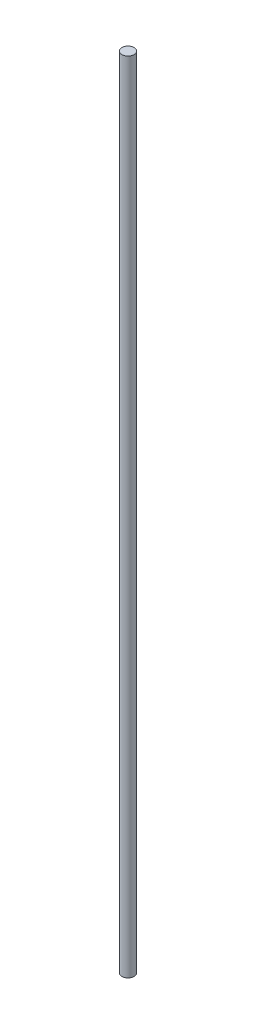
from build123d import *

# Parameters (mm, degrees)
BOSS_EXTRUDE1_DEPTH      = 195
BOSS_EXTRUDE1_DEPTH_BACK = 195
SKETCH1_R                = 3


with BuildPart() as part:
    # Sketch1 → Boss-Extrude1 (new, two sides: drawn at the far end of the back side and taken through both)
    with BuildSketch(Plane(origin=(0, 0, 0), x_dir=(1, 0, 0), z_dir=(0, 1, 0)).offset(-BOSS_EXTRUDE1_DEPTH_BACK)):
        Circle(SKETCH1_R)
    extrude(amount=BOSS_EXTRUDE1_DEPTH + BOSS_EXTRUDE1_DEPTH_BACK)


solid = part.part
